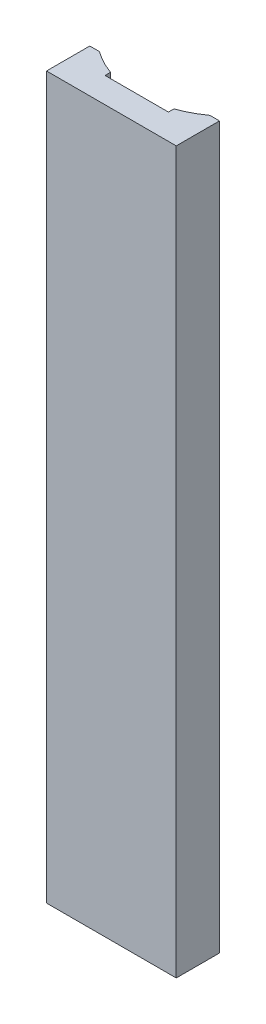
from build123d import *

# Parameters (mm, degrees)
RUNDUNG_DEPTH        = 250
SKIZZE2_W            = 22
SKIZZE2_H            = 3.270726357
AUSSPARUNGLAUF_DEPTH = 252.122480077


with BuildPart() as part:
    # Skizze1 → Rundung (new body)
    with BuildSketch(Plane(origin=(0, 0, 0), x_dir=(1, 0, 0), z_dir=(0, 1, 0))):
        with BuildLine():
            Line((-19.158288024, 7.5), (-22.5, 7.5))
            Line((-22.5, 7.5), (-22.5, -7.5))
            Line((-22.5, -7.5), (22.5, -7.5))
            Line((22.5, -7.5), (22.5, 7.5))
            Line((22.5, 7.5), (19.158288024, 7.5))
            ThreePointArc((19.158288024, 7.5), (0, 1.3), (-19.158288024, 7.5))
        make_face()
    extrude(amount=RUNDUNG_DEPTH)

    # Skizze2 → AussparungLauf (cut, through all)
    with BuildSketch(Plane(origin=(0, 250, 0), x_dir=(1, 0, 0), z_dir=(0, 1, 0))):
        with Locations((0, 2.935363178)):
            Rectangle(SKIZZE2_W, SKIZZE2_H)
    extrude(amount=-AUSSPARUNGLAUF_DEPTH, mode=Mode.SUBTRACT)


solid = part.part
